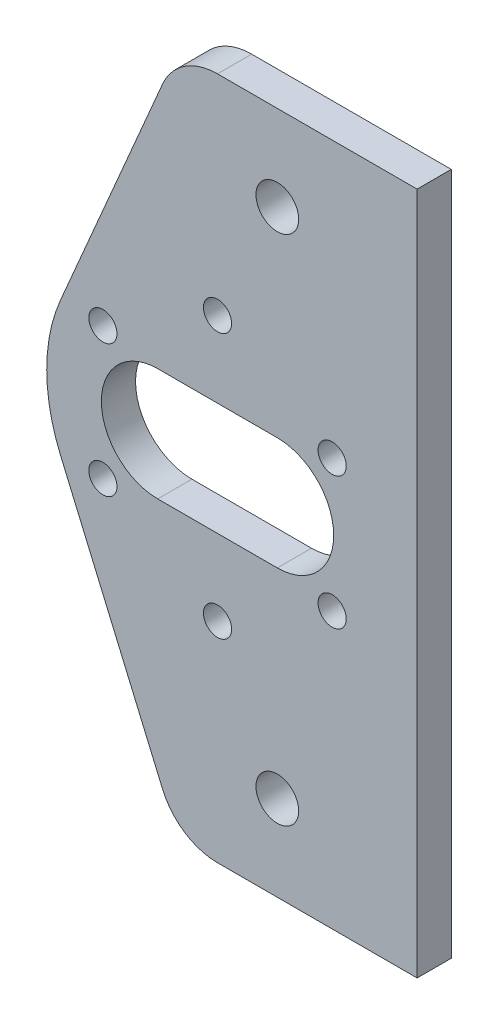
from build123d import *

# Parameters (mm, degrees)
SKETCH1_R           = 2.5
SKETCH1_R_2         = 1.65
BOSS_EXTRUDE1_DEPTH = 2


with BuildPart() as part:
    # Sketch1 → Boss-Extrude1 (new, symmetric)
    with BuildSketch(Plane.XY):
        with BuildLine():
            Line((0, -40), (0, 40))
            Line((0, 40), (-23.37, 40))
            ThreePointArc((-23.37, 40), (-27.223373178, 38.84392977), (-29.803954922, 35.757575758))
            Line((-29.803954922, 35.757575758), (-41.752728349, 7.878787879))
            ThreePointArc((-41.752728349, 7.878787879), (-43.37, 0), (-41.752728349, -7.878787879))
            Line((-41.752728349, -7.878787879), (-29.803954922, -35.757575758))
            ThreePointArc((-29.803954922, -35.757575758), (-27.223373178, -38.84392977), (-23.37, -40))
            Line((-23.37, -40), (0, -40))
        make_face()
        with Locations((-16.37, 30)):
            Circle(SKETCH1_R, mode=Mode.SUBTRACT)
        with Locations((-16.37, -30)):
            Circle(SKETCH1_R, mode=Mode.SUBTRACT)
        with Locations((-23.37, -15.5)):
            Circle(SKETCH1_R_2, mode=Mode.SUBTRACT)
        with Locations((-36.793393759, -7.75)):
            Circle(SKETCH1_R_2, mode=Mode.SUBTRACT)
        with Locations((-36.793393759, 7.75)):
            Circle(SKETCH1_R_2, mode=Mode.SUBTRACT)
        with Locations((-23.37, 15.5)):
            Circle(SKETCH1_R_2, mode=Mode.SUBTRACT)
        with Locations((-9.946606241, 7.75)):
            Circle(SKETCH1_R_2, mode=Mode.SUBTRACT)
        with Locations((-9.946606241, -7.75)):
            Circle(SKETCH1_R_2, mode=Mode.SUBTRACT)
        with BuildLine():
            Line((-30.37, 6.6), (-16.37, 6.6))
            ThreePointArc((-16.37, 6.6), (-9.77, 0), (-16.37, -6.6))
            Line((-16.37, -6.6), (-30.37, -6.6))
            ThreePointArc((-30.37, -6.6), (-36.97, 0), (-30.37, 6.6))
        make_face(mode=Mode.SUBTRACT)
    extrude(amount=BOSS_EXTRUDE1_DEPTH, both=True)


solid = part.part
